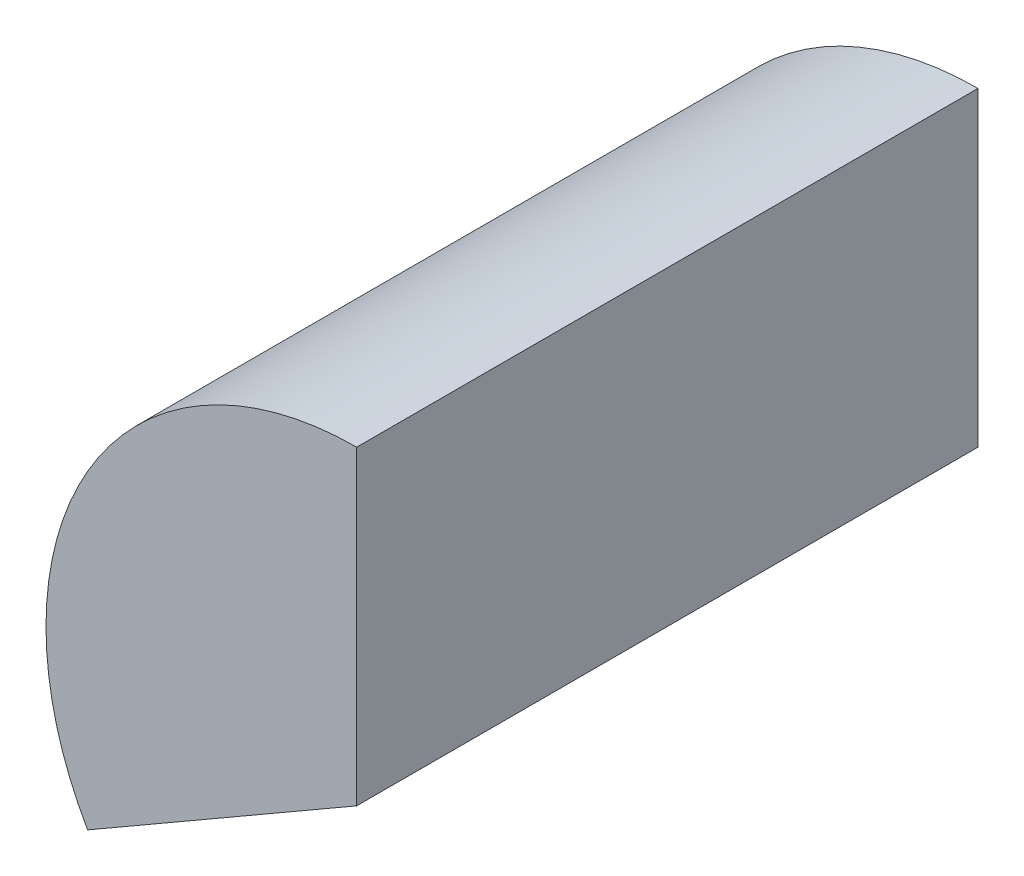
from build123d import *

# Parameters (mm, degrees)
SALIENTE_EXTRUIR1_DEPTH = 50
CROQUIS2_R              = 5
CORTAR_EXTRUIR1_DEPTH   = 10


with BuildPart() as part:
    # Croquis1 → Saliente-Extruir1 (new body)
    with BuildSketch(Plane.XY):
        with BuildLine():
            Line((0, 25), (0, 0))
            Line((0, 0), (-21.650635095, -12.5))
            ThreePointArc((-21.650635095, -12.5), (-21.650635095, 12.5), (0, 25))
        make_face()
    extrude(amount=SALIENTE_EXTRUIR1_DEPTH)

    # Croquis2 → Cortar-Extruir1 (cut)
    with BuildSketch(Plane(origin=(0, 0, 0), x_dir=(-1, 0, 0), z_dir=(0, 0, -1))):
        with Locations((11.440835451, 7.24864086)):
            Circle(CROQUIS2_R)
    extrude(amount=-CORTAR_EXTRUIR1_DEPTH, mode=Mode.SUBTRACT)


solid = part.part
